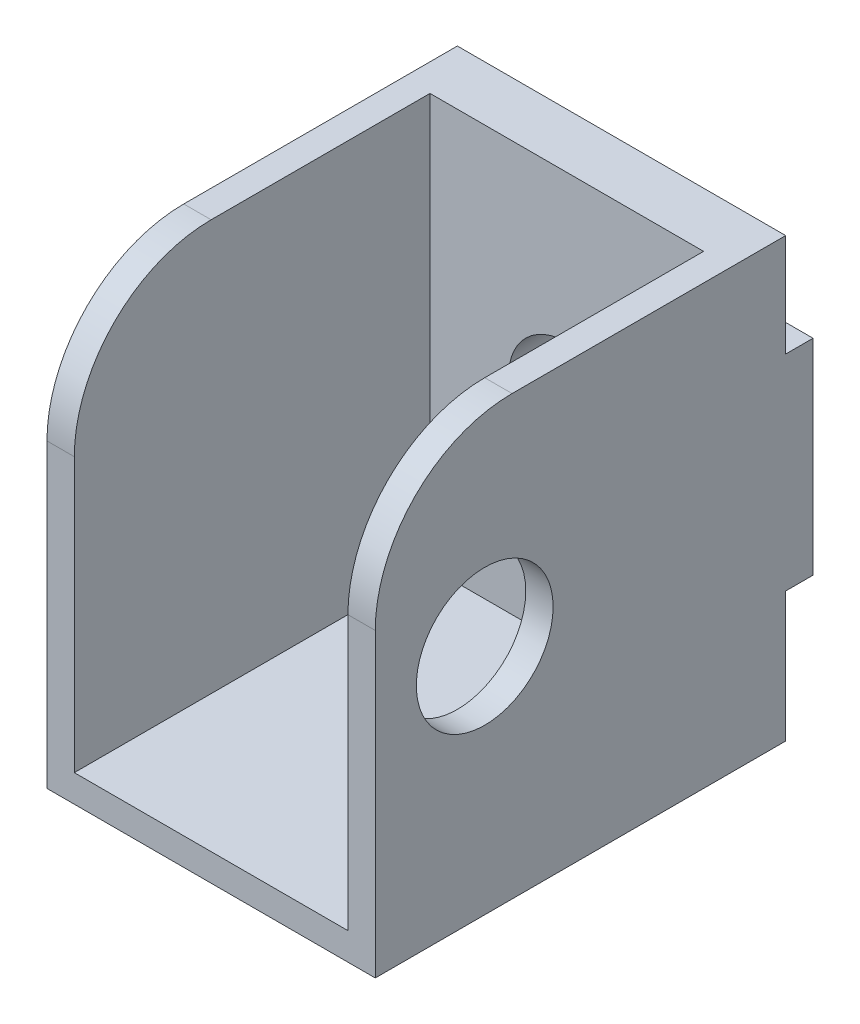
from build123d import *

# Parameters (mm, degrees)
SKETCH1_W           = 20
SKETCH1_H           = 30
SKETCH1_R           = 4.25
BOSS_EXTRUDE1_DEPTH = 4
SKETCH2_W           = 20
SKETCH2_H           = 30
BOSS_EXTRUDE2_DEPTH = 2
BOSS_EXTRUDE3_DEPTH = 2
BOSS_EXTRUDE4_START = 2
SKETCH5_R           = 5
BOSS_EXTRUDE4_DEPTH = 2
SKETCH6_W           = 2
SKETCH6_H           = 15
BOSS_EXTRUDE5_DEPTH = 2


with BuildPart() as part:
    # Sketch1 → Boss-Extrude1 (new body)
    with BuildSketch(Plane.XY):
        Rectangle(SKETCH1_W, SKETCH1_H)
        Circle(SKETCH1_R, mode=Mode.SUBTRACT)
    extrude(amount=BOSS_EXTRUDE1_DEPTH)

    # Sketch2 → Boss-Extrude2 (add)
    with BuildSketch(Plane(origin=(0, -15, 0), x_dir=(-1, 0, 0), z_dir=(0, -1, 0))):
        with Locations((0, -15)):
            Rectangle(SKETCH2_W, SKETCH2_H)
    extrude(amount=BOSS_EXTRUDE2_DEPTH)

    # Sketch4 → Boss-Extrude3 (add)
    with BuildSketch(Plane.ZY.offset(10)):
        with BuildLine():
            Line((0, 15), (20, 15))
            ThreePointArc((20, 15), (27.071067812, 12.071067812), (30, 5))
            Line((30, 5), (30, -17))
            Line((30, -17), (0, -17))
            Line((0, -17), (0, 15))
        make_face()
    extrude(amount=BOSS_EXTRUDE3_DEPTH)

    # Sketch5 → Boss-Extrude4 (add)
    with BuildSketch(Plane(origin=(10, 0, 0), x_dir=(0, 0, -1), z_dir=(1, 0, 0)).offset(BOSS_EXTRUDE4_START)):
        with BuildLine():
            Line((0, 15), (-20, 15))
            ThreePointArc((-20, 15), (-27.071067812, 12.071067812), (-30, 5))
            Line((-30, 5), (-30, -17))
            Line((-30, -17), (0, -17))
            Line((0, -17), (0, 15))
        make_face()
        with Locations((-22, 0)):
            Circle(SKETCH5_R, mode=Mode.SUBTRACT)
    extrude(amount=-BOSS_EXTRUDE4_DEPTH)

    # Sketch6 → Boss-Extrude5 (add)
    with BuildSketch(Plane(origin=(0, 0, 0), x_dir=(-1, 0, 0), z_dir=(0, 0, -1))):
        with Locations((-11, 0)):
            Rectangle(SKETCH6_W, SKETCH6_H)
        with Locations((11, 0)):
            Rectangle(SKETCH6_W, SKETCH6_H)
    extrude(amount=BOSS_EXTRUDE5_DEPTH)


solid = part.part
